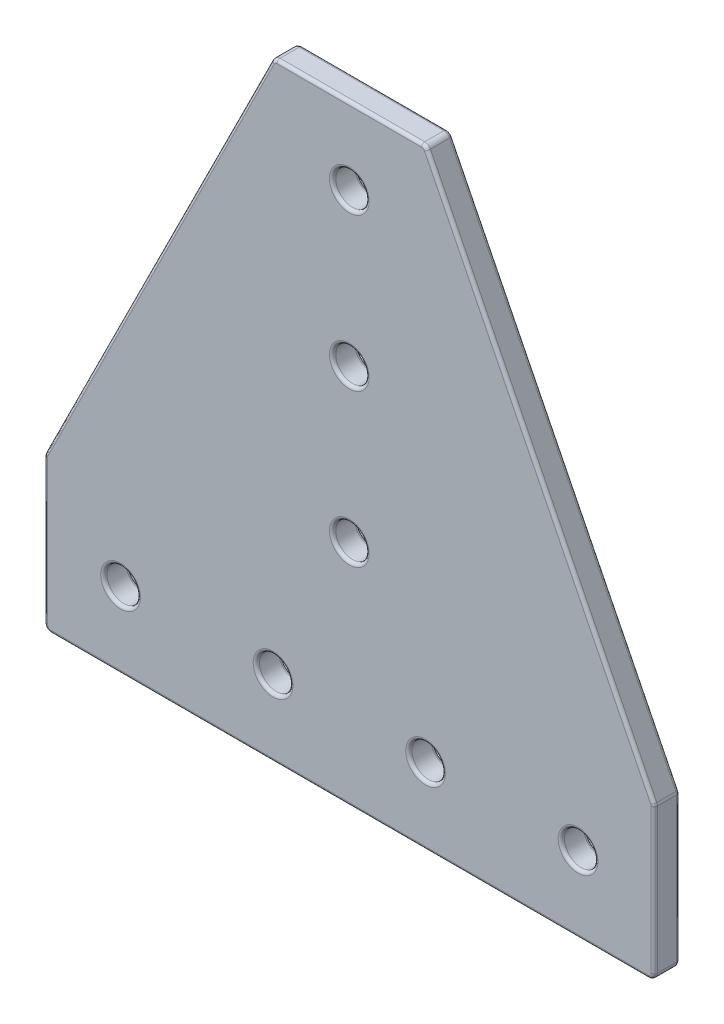
from build123d import *

# Parameters (mm, degrees)
BOSS_EXTRUDE1_DEPTH      = 3.175
BOSS_EXTRUDE1_DEPTH_BACK = 3.175
SKETCH3_R                = 4.1656
FILLET1_R                = 1.5875
FILLET2_R                = 0.79375


with BuildPart() as part:
    # Sketch3 → Boss-Extrude1 (new, two sides: drawn at the far end of the back side and taken through both)
    with BuildSketch(Plane.XY.offset(-BOSS_EXTRUDE1_DEPTH_BACK)):
        Polygon((76.2, -19.05), (76.2, 19.05), (19.05, 133.35), (-19.05, 133.35), (-76.2, 19.05), (-76.2, -19.05), align=None)
        with Locations((-57.15, 0)):
            Circle(SKETCH3_R, mode=Mode.SUBTRACT)
        with Locations((-19.05, 0)):
            Circle(SKETCH3_R, mode=Mode.SUBTRACT)
        with Locations((57.15, 0)):
            Circle(SKETCH3_R, mode=Mode.SUBTRACT)
        with Locations((19.05, 0)):
            Circle(SKETCH3_R, mode=Mode.SUBTRACT)
        with Locations((0, 38.1)):
            Circle(SKETCH3_R, mode=Mode.SUBTRACT)
        with Locations((0, 76.2)):
            Circle(SKETCH3_R, mode=Mode.SUBTRACT)
        with Locations((0, 114.3)):
            Circle(SKETCH3_R, mode=Mode.SUBTRACT)
    extrude(amount=BOSS_EXTRUDE1_DEPTH + BOSS_EXTRUDE1_DEPTH_BACK)

    # Fillet1
    fillet1_edges = [part.edges().sort_by_distance(p)[0] for p in [
        (-76.2, 19.05, 0),
        (-19.05, 133.35, 0),
        (19.05, 133.35, 0),
        (76.2, 19.05, 0),
        (76.2, -19.05, 0),
        (-76.2, -19.05, 0),
    ]]
    fillet(fillet1_edges, radius=FILLET1_R)

    # Fillet2
    fillet2_edges = [part.edges().sort_by_distance(p)[0] for p in [
        (-61.3156, 0, 3.175),
        (-23.2156, 0, 3.175),
        (52.9844, 0, 3.175),
        (14.8844, 0, 3.175),
        (-4.1656, 38.1, 3.175),
        (-4.1656, 76.2, 3.175),
        (-4.1656, 114.3, 3.175),
        (-4.1656, 114.3, -3.175),
        (-4.1656, 76.2, -3.175),
        (-4.1656, 38.1, -3.175),
        (14.8844, 0, -3.175),
        (52.9844, 0, -3.175),
        (-23.2156, 0, -3.175),
        (-61.3156, 0, -3.175),
        (0, -19.05, -3.175),
        (0, -19.05, 3.175),
        (-76.2, 0.606371043, -3.175),
        (-47.760588687, 75.928822626, -3.175),
        (0, 133.35, -3.175),
        (47.760588687, 75.928822626, -3.175),
        (76.2, 0.606371043, -3.175),
        (76.157532771, 19.039974847, -3.175),
        (18.903469183, 133.112908158, -3.175),
        (75.735032015, -18.585032015, -3.175),
        (-18.903469183, 133.112908158, -3.175),
        (-76.157532771, 19.039974847, -3.175),
        (-75.735032015, -18.585032015, -3.175),
        (-76.2, 0.606371043, 3.175),
        (76.2, 0.606371043, 3.175),
        (47.760588687, 75.928822626, 3.175),
        (0, 133.35, 3.175),
        (-47.760588687, 75.928822626, 3.175),
        (76.157532771, 19.039974847, 3.175),
        (18.903469183, 133.112908158, 3.175),
        (75.735032015, -18.585032015, 3.175),
        (-18.903469183, 133.112908158, 3.175),
        (-76.157532771, 19.039974847, 3.175),
        (-75.735032015, -18.585032015, 3.175),
    ]]
    fillet(fillet2_edges, radius=FILLET2_R)


solid = part.part
